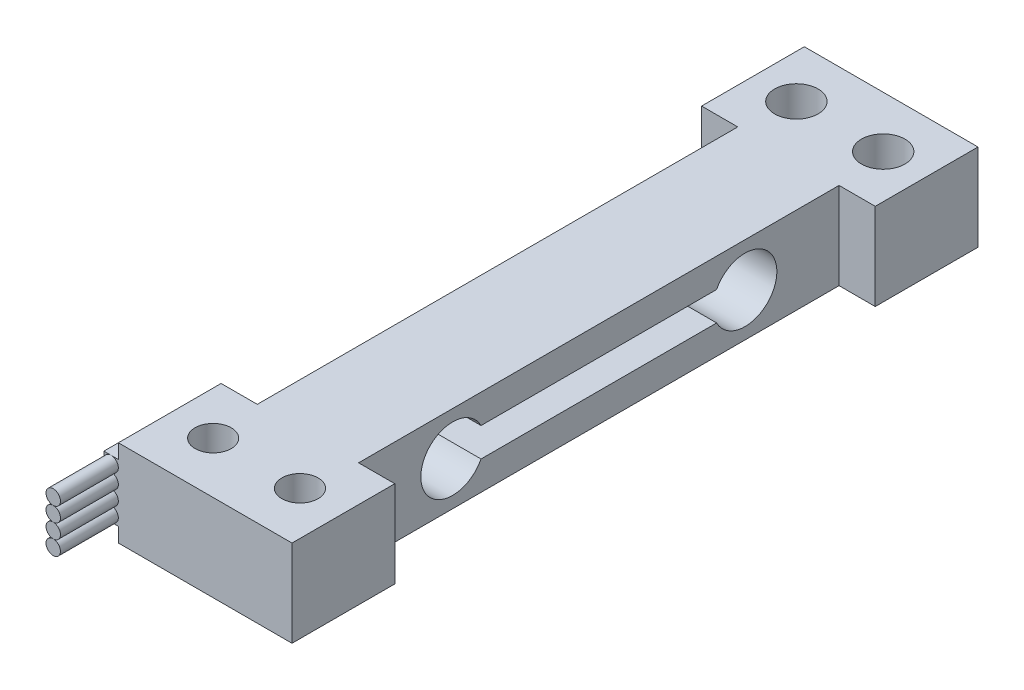
from build123d import *

# Parameters (mm, degrees)
BOSS_EXTRUDE1_DEPTH     = 6
F_3_0MM_DOWEL_HOLE1_D   = 3
TAP_DRILL_FOR_M3_TAP1_D = 2.5
BOSS_EXTRUDE2_DEPTH     = 0.25
CUT_EXTRUDE1_REACH      = 50.957
SKETCH7_W               = 4.6
SKETCH7_H               = 4
BOSS_EXTRUDE3_DEPTH     = 1
SKETCH8_R               = 0.5
BOSS_EXTRUDE5_DEPTH     = 4
BOSS_EXTRUDE5_2_DEPTH   = 4
BOSS_EXTRUDE5_3_DEPTH   = 4
BOSS_EXTRUDE5_4_DEPTH   = 4


with BuildPart() as part:
    # Sketch1 → Boss-Extrude1 (new body)
    with BuildSketch(Plane(origin=(0, 0, 0), x_dir=(1, 0, 0), z_dir=(0, 1, 0))):
        Polygon((2.5, 7.1), (2.5, 40.3), (0, 40.3), (0, 47.4), (12, 47.4), (12, 40.3), (9.5, 40.3), (9.5, 7.1), (12, 7.1), (12, 0), (0, 0), (0, 7.1), align=None)
    extrude(amount=BOSS_EXTRUDE1_DEPTH)

    # Ø3.0mm Dowel Hole1 (through all)
    with Locations(Plane(origin=(3, 6, -43.85), x_dir=(0, 0, 1), z_dir=(0, 1, 0))):
        with Locations((0, 0), (0, 6)):
            Hole(F_3_0MM_DOWEL_HOLE1_D / 2)

    # Tap Drill for M3 Tap1 (through all)
    with Locations(Plane(origin=(9, 6, -3.55), x_dir=(0, 0, 1), z_dir=(0, 1, 0))):
        with Locations((0, 0), (0, -6)):
            Hole(TAP_DRILL_FOR_M3_TAP1_D / 2)

    # Sketch5 → Boss-Extrude2 (add)
    with BuildSketch(Plane(origin=(0, 0, -47.4), x_dir=(-1, 0, 0), z_dir=(0, 0, -1))):
        Polygon((-6.75, 5), (-5.25, 5), (-5.25, 2.680048343), (-4, 2.680048343), (-6, 1), (-8, 2.680048343), (-6.75, 2.680048343), align=None)
    extrude(amount=BOSS_EXTRUDE2_DEPTH)

    # Sketch6 → Cut-Extrude1 (cut, up to next)
    with BuildSketch(Plane(origin=(9.5, 0, 0), x_dir=(0, 0, -1), z_dir=(1, 0, 0)), mode=Mode.PRIVATE) as cut_extrude1_sk1:
        with BuildLine():
            Line((15.559591794, 4), (31.840408206, 4))
            ThreePointArc((31.840408206, 4), (36, 3), (31.840408206, 2))
            Line((31.840408206, 2), (15.559591794, 2))
            ThreePointArc((15.559591794, 2), (11.4, 3), (15.559591794, 4))
        make_face()
    cut_extrude1_tool1 = extrude(cut_extrude1_sk1.sketch, amount=-CUT_EXTRUDE1_REACH, mode=Mode.PRIVATE) & part.part
    add(cut_extrude1_tool1.solids().sort_by_distance((9.5, 3, -23.7))[0], mode=Mode.SUBTRACT)

    # Sketch7 → Boss-Extrude3 (add)
    with BuildSketch(Plane.ZY):
        with Locations((-2.3, 3)):
            Rectangle(SKETCH7_W, SKETCH7_H)
    extrude(amount=BOSS_EXTRUDE3_DEPTH)


with BuildPart() as body_2:
    # Sketch8 → Boss-Extrude5 (new body)
    with BuildSketch(Plane.XY):
        with Locations((-0.5, 4.5)):
            Circle(SKETCH8_R)
    extrude(amount=BOSS_EXTRUDE5_DEPTH)


with BuildPart() as body_3:
    # Sketch8 → Boss-Extrude5 2 (new body)
    with BuildSketch(Plane.XY):
        with Locations((-0.5, 1.5)):
            Circle(SKETCH8_R)
    extrude(amount=BOSS_EXTRUDE5_2_DEPTH)


with BuildPart() as body_4:
    # Sketch8 → Boss-Extrude5 3 (new body)
    with BuildSketch(Plane.XY):
        with BuildLine():
            ThreePointArc((-0.5, 2), (0, 2.5), (-0.5, 3))
            ThreePointArc((-0.5, 3), (-1, 2.5), (-0.5, 2))
        make_face()
    extrude(amount=BOSS_EXTRUDE5_3_DEPTH)


with BuildPart() as body_5:
    # Sketch8 → Boss-Extrude5 4 (new body)
    with BuildSketch(Plane.XY):
        with BuildLine():
            ThreePointArc((-0.5, 3), (0, 3.5), (-0.5, 4))
            ThreePointArc((-0.5, 4), (-1, 3.5), (-0.5, 3))
        make_face()
    extrude(amount=BOSS_EXTRUDE5_4_DEPTH)


solid = Compound([part.part, body_2.part, body_3.part, body_4.part, body_5.part])
